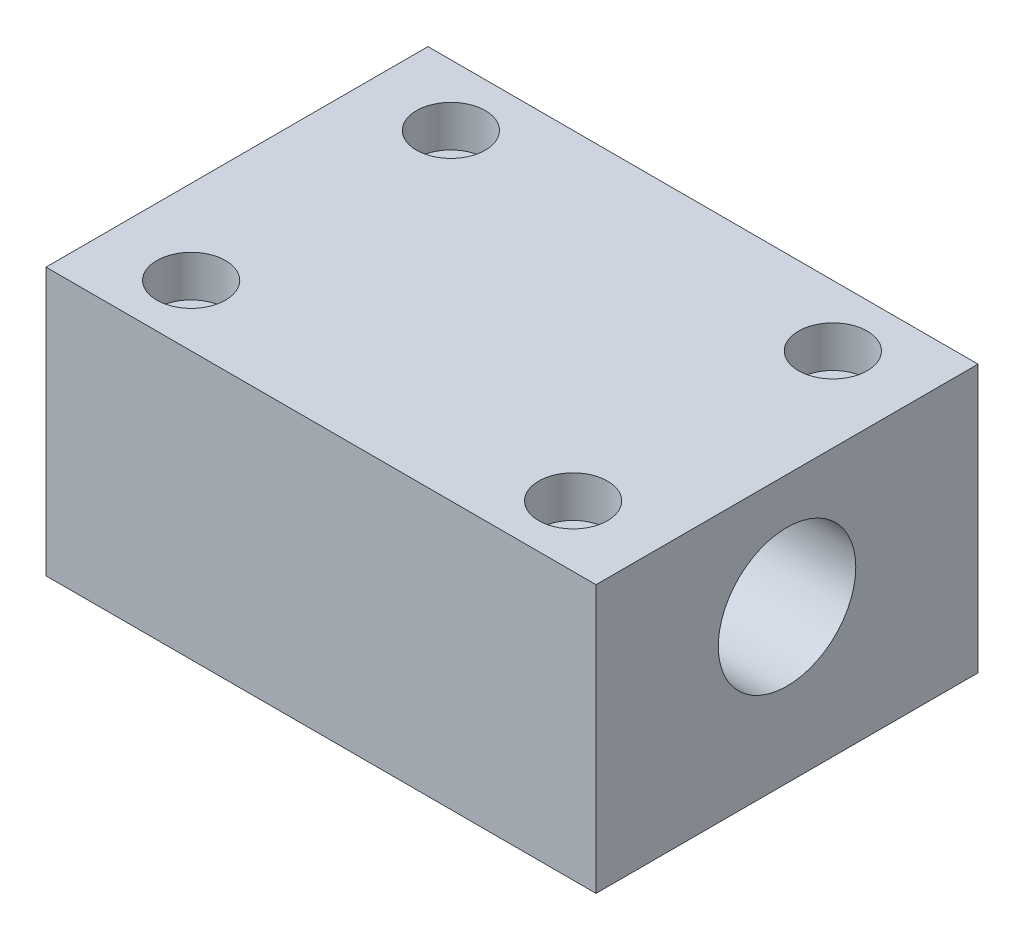
from build123d import *

# Parameters (mm, degrees)
SKETCH_HOUSING_PROFILE_W             = 50
SKETCH_HOUSING_PROFILE_H             = 35
HOUSING_BLOCK_72X50X35_DEPTH         = 72
SKETCH_WEB_CLEARANCE_HOLE_9_R        = 4.5
WEB_CLEARANCE_HOLE_9_DEPTH           = 3
SKETCH_REAR_BUSHING_BORE_12_R        = 6
REAR_BUSHING_BORE_12_H7_DEPTH        = 12
SKETCH_SPRING_BORE_13_R              = 6.5
SPRING_POCKET_BORE_13_DEPTH          = 40
SKETCH_FRONT_BUSHING_BORE_18_R       = 9
FRONT_BUSHING_BORE_18_H7_DEPTH       = 17
SKETCH_MOUNTING_CLEARANCE_HOLES_M5_R = 2.75
MOUNTING_CLEARANCE_HOLES_M5_DEPTH    = 35
SKETCH_MOUNTING_COUNTERBORES_9_R     = 4.5
MOUNTING_COUNTERBORES_9X5P4_DEPTH    = 5.4


with BuildPart() as part:
    # Sketch_Housing_Profile → Housing_Block_72x50x35 (new body)
    with BuildSketch(Plane(origin=(0, 0, 0), x_dir=(0, 0, -1), z_dir=(1, 0, 0))):
        with Locations((0, -2.5)):
            Rectangle(SKETCH_HOUSING_PROFILE_W, SKETCH_HOUSING_PROFILE_H)
    extrude(amount=HOUSING_BLOCK_72X50X35_DEPTH)

    # Sketch_Web_Clearance_Hole_9 → Web_Clearance_Hole_9 (cut)
    with BuildSketch(Plane(origin=(0, 0, 0), x_dir=(0, 0, -1), z_dir=(1, 0, 0))):
        Circle(SKETCH_WEB_CLEARANCE_HOLE_9_R)
    extrude(amount=WEB_CLEARANCE_HOLE_9_DEPTH, mode=Mode.SUBTRACT)

    # Sketch_Rear_Bushing_Bore_12 → Rear_Bushing_Bore_12_H7 (cut)
    with BuildSketch(Plane(origin=(3, 0, 0), x_dir=(0, 0, -1), z_dir=(1, 0, 0))):
        Circle(SKETCH_REAR_BUSHING_BORE_12_R)
    extrude(amount=REAR_BUSHING_BORE_12_H7_DEPTH, mode=Mode.SUBTRACT)

    # Sketch_Spring_Bore_13 → Spring_Pocket_Bore_13 (cut)
    with BuildSketch(Plane(origin=(15, 0, 0), x_dir=(0, 0, -1), z_dir=(1, 0, 0))):
        Circle(SKETCH_SPRING_BORE_13_R)
    extrude(amount=SPRING_POCKET_BORE_13_DEPTH, mode=Mode.SUBTRACT)

    # Sketch_Front_Bushing_Bore_18 → Front_Bushing_Bore_18_H7 (cut)
    with BuildSketch(Plane(origin=(55, 0, 0), x_dir=(0, 0, -1), z_dir=(1, 0, 0))):
        Circle(SKETCH_FRONT_BUSHING_BORE_18_R)
    extrude(amount=FRONT_BUSHING_BORE_18_H7_DEPTH, mode=Mode.SUBTRACT)

    # Sketch_Mounting_Clearance_Holes_M5 → Mounting_Clearance_Holes_M5 (cut)
    with BuildSketch(Plane(origin=(0, 15, 0), x_dir=(1, 0, 0), z_dir=(0, 1, 0))):
        with Locations((11, 17)):
            Circle(SKETCH_MOUNTING_CLEARANCE_HOLES_M5_R)
        with Locations((61, 17)):
            Circle(SKETCH_MOUNTING_CLEARANCE_HOLES_M5_R)
        with Locations((11, -17)):
            Circle(SKETCH_MOUNTING_CLEARANCE_HOLES_M5_R)
        with Locations((61, -17)):
            Circle(SKETCH_MOUNTING_CLEARANCE_HOLES_M5_R)
    extrude(amount=-MOUNTING_CLEARANCE_HOLES_M5_DEPTH, mode=Mode.SUBTRACT)

    # Sketch_Mounting_Counterbores_9 → Mounting_Counterbores_9x5p4 (cut)
    with BuildSketch(Plane(origin=(0, 15, 0), x_dir=(1, 0, 0), z_dir=(0, 1, 0))):
        with Locations((11, 17)):
            Circle(SKETCH_MOUNTING_COUNTERBORES_9_R)
        with Locations((61, 17)):
            Circle(SKETCH_MOUNTING_COUNTERBORES_9_R)
        with Locations((11, -17)):
            Circle(SKETCH_MOUNTING_COUNTERBORES_9_R)
        with Locations((61, -17)):
            Circle(SKETCH_MOUNTING_COUNTERBORES_9_R)
    extrude(amount=-MOUNTING_COUNTERBORES_9X5P4_DEPTH, mode=Mode.SUBTRACT)


solid = part.part
